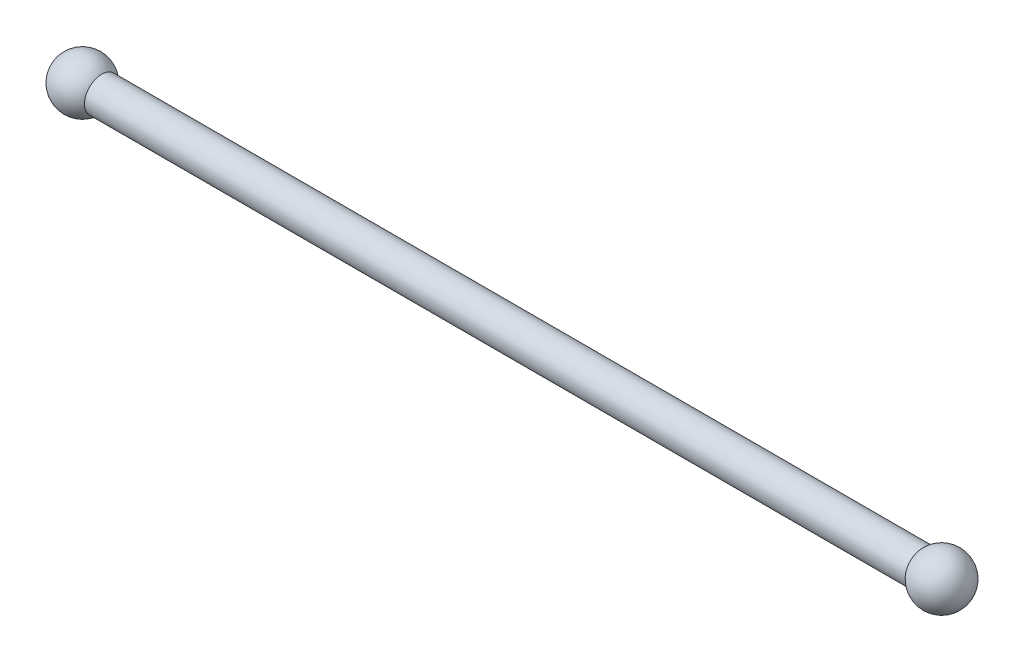
from build123d import *

# Parameters (mm, degrees)
SZKIC1_W = 125
SZKIC1_H = 5


with BuildPart() as part:
    # Szkic1 → Obrót1 (revolve)
    with BuildSketch(Plane.XY, mode=Mode.PRIVATE) as obr_t1_sk:
        with Locations((62.5, 2.5)):
            Rectangle(SZKIC1_W, SZKIC1_H)
    obr_t1 = revolve(obr_t1_sk.sketch.rotate(Axis((0, 0, 0), (1, 0, 0)), 90), axis=Axis((0, 0, 0), (1, 0, 0)))

    # Szkic2 → Obrót3 (revolve)
    with BuildSketch(Plane(origin=(125, 0, 0), x_dir=(0, 0, -1), z_dir=(1, 0, 0))):
        with BuildLine():
            Line((-7.5, 0), (7.5, 0))
            ThreePointArc((7.5, 0), (0, 7.5), (-7.5, 0))
        make_face()
    obr_t3 = revolve(axis=Axis((125, 0, 7.5), (0, 0, -1)))

    # Lustro1: Obrót1, Obrót3 across plane
    add(obr_t1.mirror(Plane(origin=(0, 0, 0), x_dir=(0, 0, 1), z_dir=(1, 0, 0))))
    add(obr_t3.mirror(Plane(origin=(0, 0, 0), x_dir=(0, 0, 1), z_dir=(1, 0, 0))))


solid = part.part
